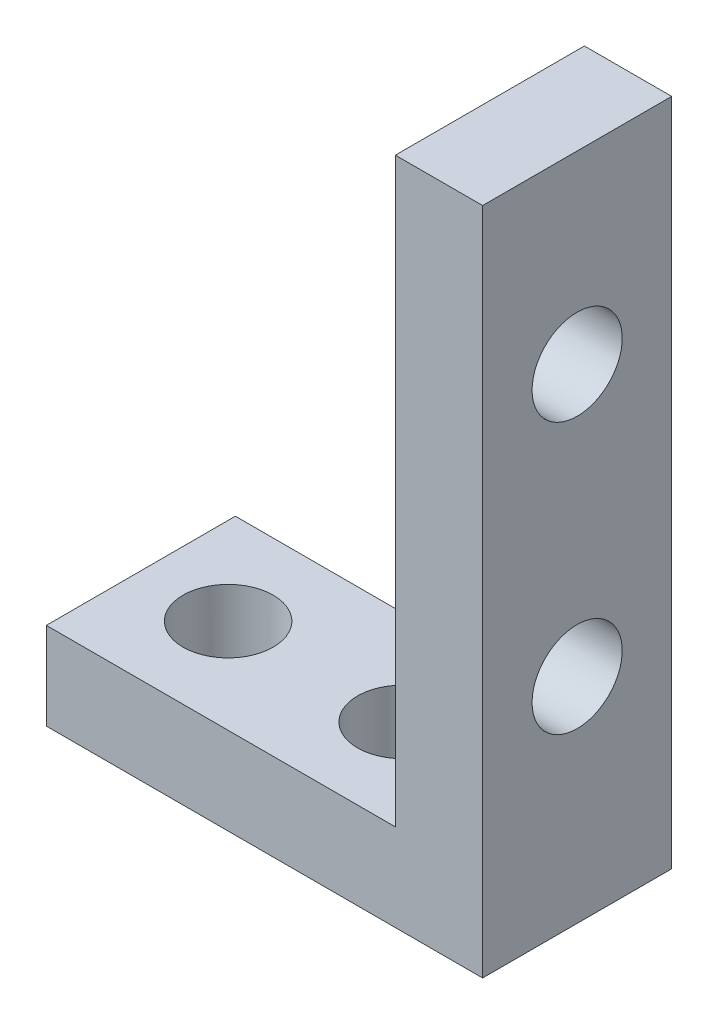
from build123d import *

# Parameters (mm, degrees)
BOSS_EXTRUDE1_DEPTH = 6.5
SKETCH2_R           = 1.55
CUT_EXTRUDE1_DEPTH  = 10
SKETCH3_R           = 1.55
CUT_EXTRUDE2_DEPTH  = 10


with BuildPart() as part:
    # Sketch1 → Boss-Extrude1 (new body)
    with BuildSketch(Plane.XY):
        Polygon((-21.361853088, -2.625), (-9.361853088, -2.625), (-9.361853088, 17.375), (-6.361853088, 17.375), (-6.361853088, -5.625), (-9.361853088, -5.625), (-21.361853088, -5.625), align=None)
    extrude(amount=BOSS_EXTRUDE1_DEPTH)

    # Sketch2 → Cut-Extrude1 (cut)
    with BuildSketch(Plane(origin=(0, -2.625, 0), x_dir=(1, 0, 0), z_dir=(0, 1, 0))):
        with Locations(Location((-12.361853088, -3.25, 0), (0, 0, 270))):
            Circle(SKETCH2_R)
        with Locations(Location((-18.361853088, -3.25, 0), (0, 0, 270))):
            Circle(SKETCH2_R)
    extrude(amount=-CUT_EXTRUDE1_DEPTH, mode=Mode.SUBTRACT)

    # Sketch3 → Cut-Extrude2 (cut)
    with BuildSketch(Plane.ZY.offset(9.361853088)):
        with Locations((3.25, 1.725)):
            Circle(SKETCH3_R)
        with Locations((3.25, 11.025)):
            Circle(SKETCH3_R)
    extrude(amount=-CUT_EXTRUDE2_DEPTH, mode=Mode.SUBTRACT)


solid = part.part
